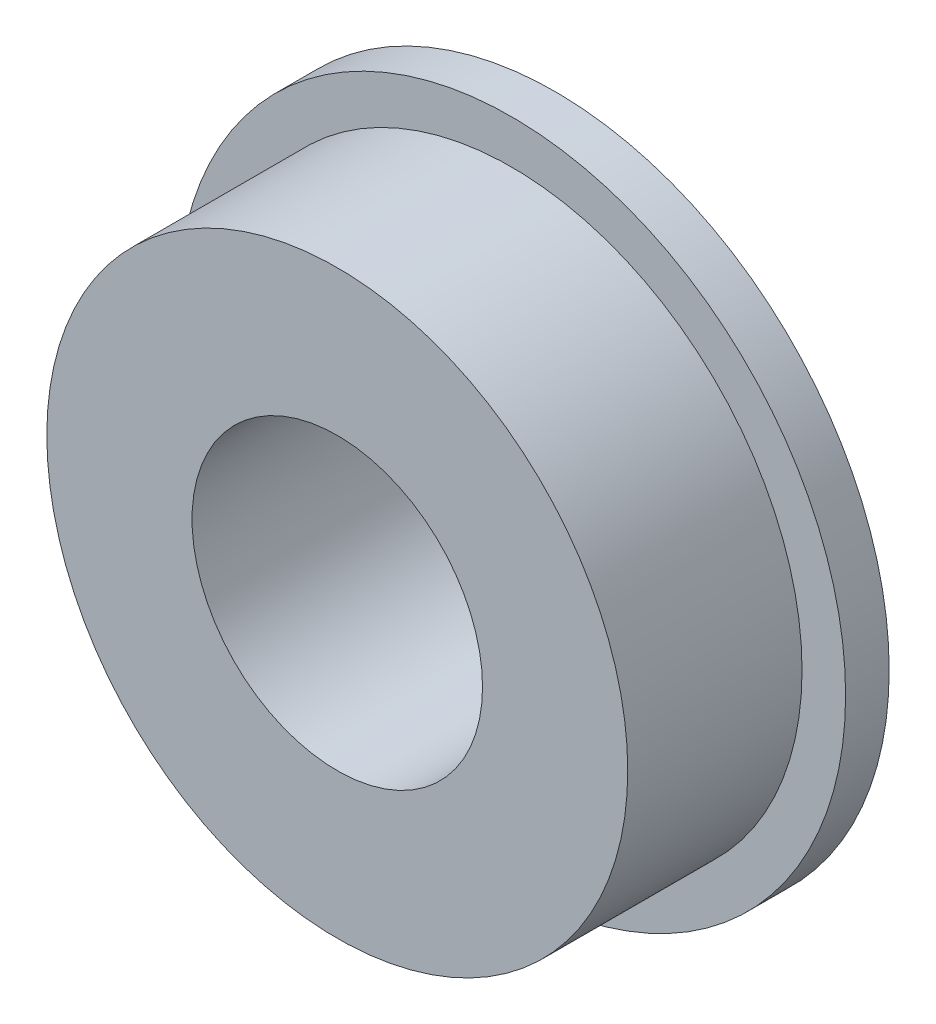
from build123d import *

# Parameters (mm, degrees)
SKETCH_1_R          = 4.6
EXTRUDE_1_DEPTH     = 0.6
SKETCH_2_R          = 4
EXTRUDE_2_DEPTH     = 2.4
SKETCH_3_R          = 2
CUT_EXTRUDE_1_DEPTH = 8.163797875


with BuildPart() as part:
    # 草图1 → 凸台-拉伸1 (new body)
    with BuildSketch(Plane.XY):
        Circle(SKETCH_1_R)
    extrude(amount=EXTRUDE_1_DEPTH)

    # 草图2 → 凸台-拉伸2 (add)
    with BuildSketch(Plane.XY.offset(0.6)):
        Circle(SKETCH_2_R)
    extrude(amount=EXTRUDE_2_DEPTH)

    # 草图3 → 切除-拉伸1 (cut, through all)
    with BuildSketch(Plane.XY.offset(3)):
        Circle(SKETCH_3_R)
    extrude(amount=-CUT_EXTRUDE_1_DEPTH, mode=Mode.SUBTRACT)


solid = part.part
